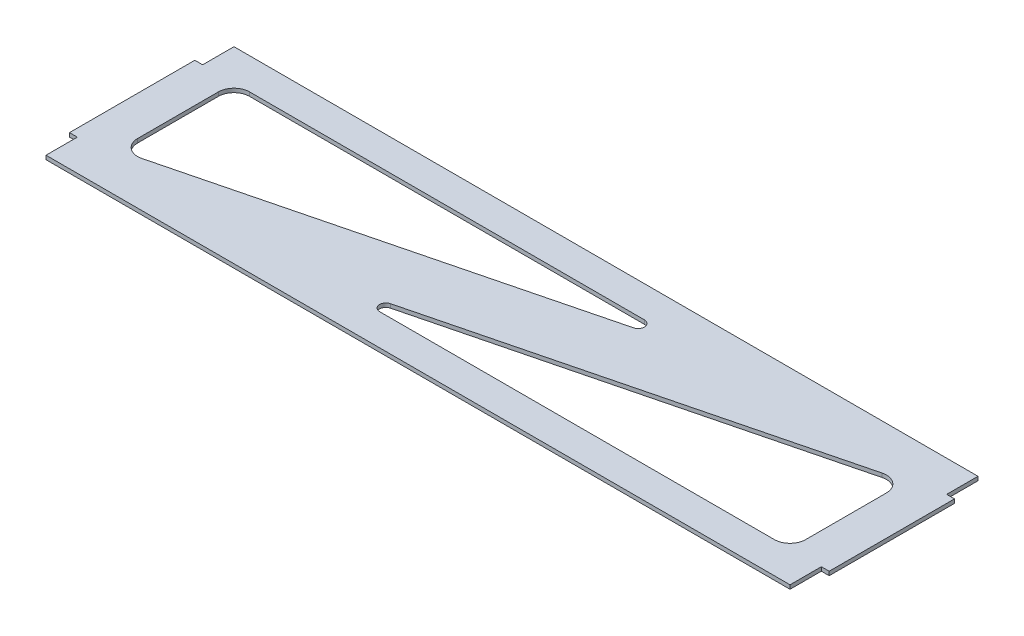
from build123d import *

# Parameters (mm, degrees)
BOSS_EXTRUDE1_DEPTH = 1.5875
CUT_EXTRUDE1_DEPTH  = 159.638836079


with BuildPart() as part:
    # Sketch1 → Boss-Extrude1 (new body)
    with BuildSketch(Plane(origin=(0, 0, 0), x_dir=(1, 0, 0), z_dir=(0, 1, 0))):
        Polygon((-150.8125, 25.4), (-153.9875, 25.4), (-153.9875, -25.4), (-150.8125, -25.4), (-150.8125, -38.1), (150.8125, -38.1), (150.8125, -25.4), (153.9875, -25.4), (153.9875, 25.4), (150.8125, 25.4), (150.8125, 38.1), (-150.8125, 38.1), align=None)
    extrude(amount=BOSS_EXTRUDE1_DEPTH)

    # Sketch2 → Cut-Extrude1 (cut, through all)
    with BuildSketch(Plane(origin=(0, 1.5875, 0), x_dir=(1, 0, 0), z_dir=(0, 1, 0))):
        with BuildLine():
            Line((-138.1125, 19.05), (-138.1125, -13.638858994))
            ThreePointArc((-138.1125, -13.638858994), (-135.664170115, -18.648796151), (-130.207155019, -19.795432878))
            Line((-130.207155019, -19.795432878), (28.889358139, 20.397370446))
            ThreePointArc((28.889358139, 20.397370446), (30.78780332, 23.173465256), (28.267220147, 25.4))
            Line((28.267220147, 25.4), (-131.7625, 25.4))
            ThreePointArc((-131.7625, 25.4), (-136.252628061, 23.540128061), (-138.1125, 19.05))
        make_face()
        with BuildLine():
            Line((-28.267220147, -25.4), (131.7625, -25.4))
            ThreePointArc((131.7625, -25.4), (136.252628061, -23.540128061), (138.1125, -19.05))
            Line((138.1125, -19.05), (138.1125, 13.638858994))
            ThreePointArc((138.1125, 13.638858994), (135.664170115, 18.648796151), (130.207155019, 19.795432878))
            Line((130.207155019, 19.795432878), (-28.889358139, -20.397370446))
            ThreePointArc((-28.889358139, -20.397370446), (-30.78780332, -23.173465256), (-28.267220147, -25.4))
        make_face()
    extrude(amount=-CUT_EXTRUDE1_DEPTH, mode=Mode.SUBTRACT)


solid = part.part
